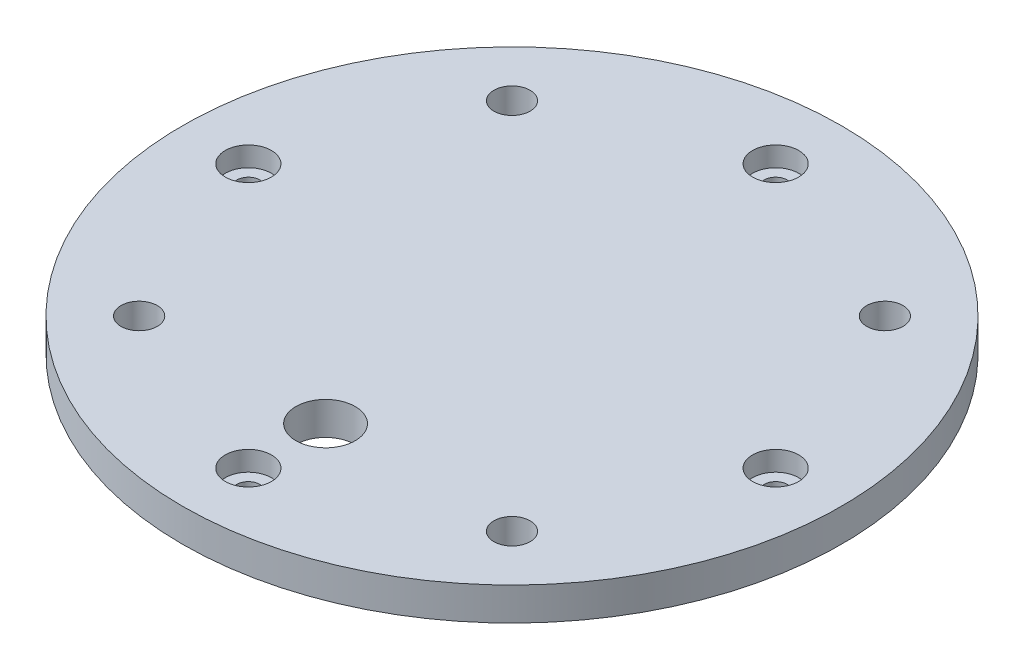
from build123d import *

# Parameters (mm, degrees)
SKETCH_1_R          = 50
EXTRUDE_1_DEPTH     = 5
SKETCH_2_R          = 1.75
CUT_EXTRUDE_1_DEPTH = 12
SKETCH_3_R          = 3.5
CUT_EXTRUDE_2_DEPTH = 3
SKETCH_4_R          = 2.75
CUT_EXTRUDE_3_DEPTH = 24
SKETCH_5_R          = 4.5
CUT_EXTRUDE_4_DEPTH = 16


with BuildPart() as part:
    # 草图1 → 凸台-拉伸1 (new body)
    with BuildSketch(Plane(origin=(0, 0, 0), x_dir=(1, 0, 0), z_dir=(0, 1, 0))):
        with Locations(Location((0, 0, 0), (0, 0, 270))):
            Circle(SKETCH_1_R)
    extrude(amount=EXTRUDE_1_DEPTH)

    # 草图2 → 切除-拉伸1 (cut)
    with BuildSketch(Plane(origin=(0, 5, 0), x_dir=(1, 0, 0), z_dir=(0, 1, 0))):
        with Locations(Location((0, 40, 0), (0, 0, 270))):
            Circle(SKETCH_2_R)
        with Locations(Location((40, 0, 0), (0, 0, 270))):
            Circle(SKETCH_2_R)
        with Locations(Location((0, -40, 0), (0, 0, 270))):
            Circle(SKETCH_2_R)
        with Locations(Location((-40, 0, 0), (0, 0, 270))):
            Circle(SKETCH_2_R)
    extrude(amount=-CUT_EXTRUDE_1_DEPTH, mode=Mode.SUBTRACT)

    # 草图3 → 切除-拉伸2 (cut)
    with BuildSketch(Plane(origin=(0, 5, 0), x_dir=(1, 0, 0), z_dir=(0, 1, 0))):
        with Locations(Location((0, 40, 0), (0, 0, 270))):
            Circle(SKETCH_3_R)
        with Locations(Location((40, 0, 0), (0, 0, 270))):
            Circle(SKETCH_3_R)
        with Locations(Location((0, -40, 0), (0, 0, 270))):
            Circle(SKETCH_3_R)
        with Locations(Location((-40, 0, 0), (0, 0, 270))):
            Circle(SKETCH_3_R)
    extrude(amount=-CUT_EXTRUDE_2_DEPTH, mode=Mode.SUBTRACT)

    # 草图4 → 切除-拉伸3 (cut)
    with BuildSketch(Plane(origin=(0, 5, 0), x_dir=(1, 0, 0), z_dir=(0, 1, 0))):
        with Locations(Location((28.284271247, 28.284271247, 0), (0, 0, 270))):
            Circle(SKETCH_4_R)
        with Locations(Location((28.284271247, -28.284271247, 0), (0, 0, 270))):
            Circle(SKETCH_4_R)
        with Locations(Location((-28.284271247, -28.284271247, 0), (0, 0, 270))):
            Circle(SKETCH_4_R)
        with Locations(Location((-28.284271247, 28.284271247, 0), (0, 0, 270))):
            Circle(SKETCH_4_R)
    extrude(amount=-CUT_EXTRUDE_3_DEPTH, mode=Mode.SUBTRACT)

    # 草图5 → 切除-拉伸4 (cut)
    with BuildSketch(Plane(origin=(0, 5, 0), x_dir=(1, 0, 0), z_dir=(0, 1, 0))):
        with Locations(Location((0, -28.284271247, 0), (0, 0, 270))):
            Circle(SKETCH_5_R)
    extrude(amount=-CUT_EXTRUDE_4_DEPTH, mode=Mode.SUBTRACT)


solid = part.part
